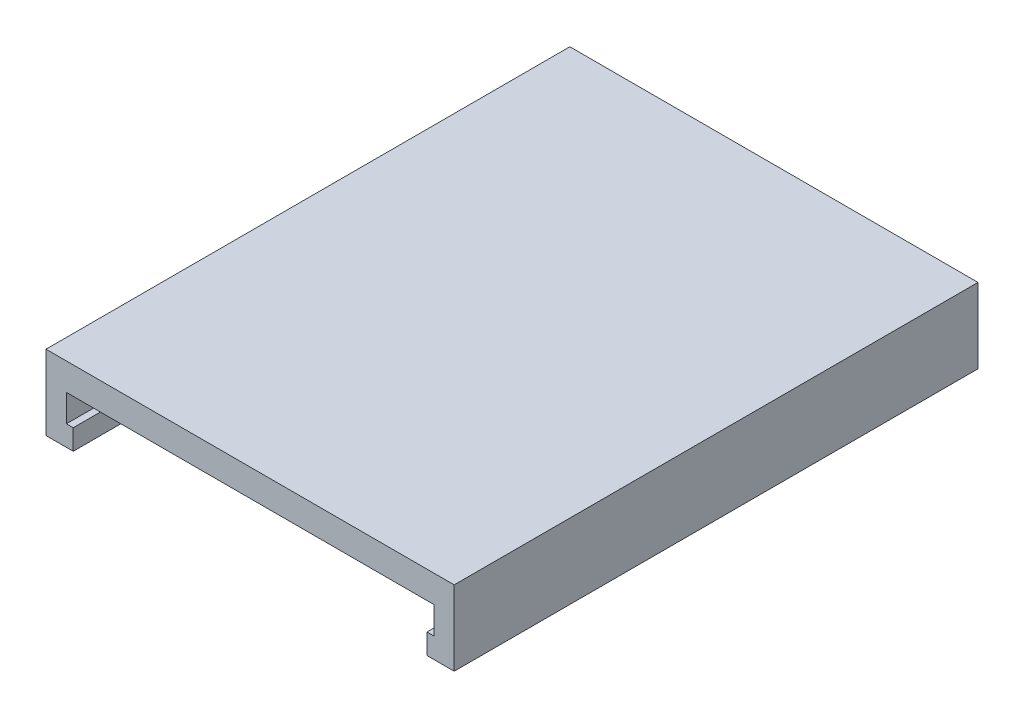
from build123d import *

# Parameters (mm, degrees)
EXTRUDE_1_DEPTH = 72
SKETCH_2_W      = 4
SKETCH_2_H      = 72
EXTRUDE_2_DEPTH = 3
SKETCH_4_W      = 60
SKETCH_4_H      = 11
EXTRUDE_3_DEPTH = 5


with BuildPart() as part:
    # 스케치1 → 보스-돌출1 (new body)
    with BuildSketch(Plane.XY):
        Polygon((-3, 0), (0, 0), (0, 4), (54, 4), (54, 0), (57, 0), (57, 8), (-3, 8), align=None)
    extrude(amount=EXTRUDE_1_DEPTH)

    # 스케치2 → 보스-돌출2 (add)
    with BuildSketch(Plane.XZ):
        with Locations((-1, 36)):
            Rectangle(SKETCH_2_W, SKETCH_2_H)
        with Locations((55, 36)):
            Rectangle(SKETCH_2_W, SKETCH_2_H)
    extrude(amount=EXTRUDE_2_DEPTH)

    # 스케치4 → 보스-돌출3 (add)
    with BuildSketch(Plane(origin=(0, 0, 0), x_dir=(-1, 0, 0), z_dir=(0, 0, -1))):
        with Locations((-27, 2.5)):
            Rectangle(SKETCH_4_W, SKETCH_4_H)
    extrude(amount=EXTRUDE_3_DEPTH)


solid = part.part
